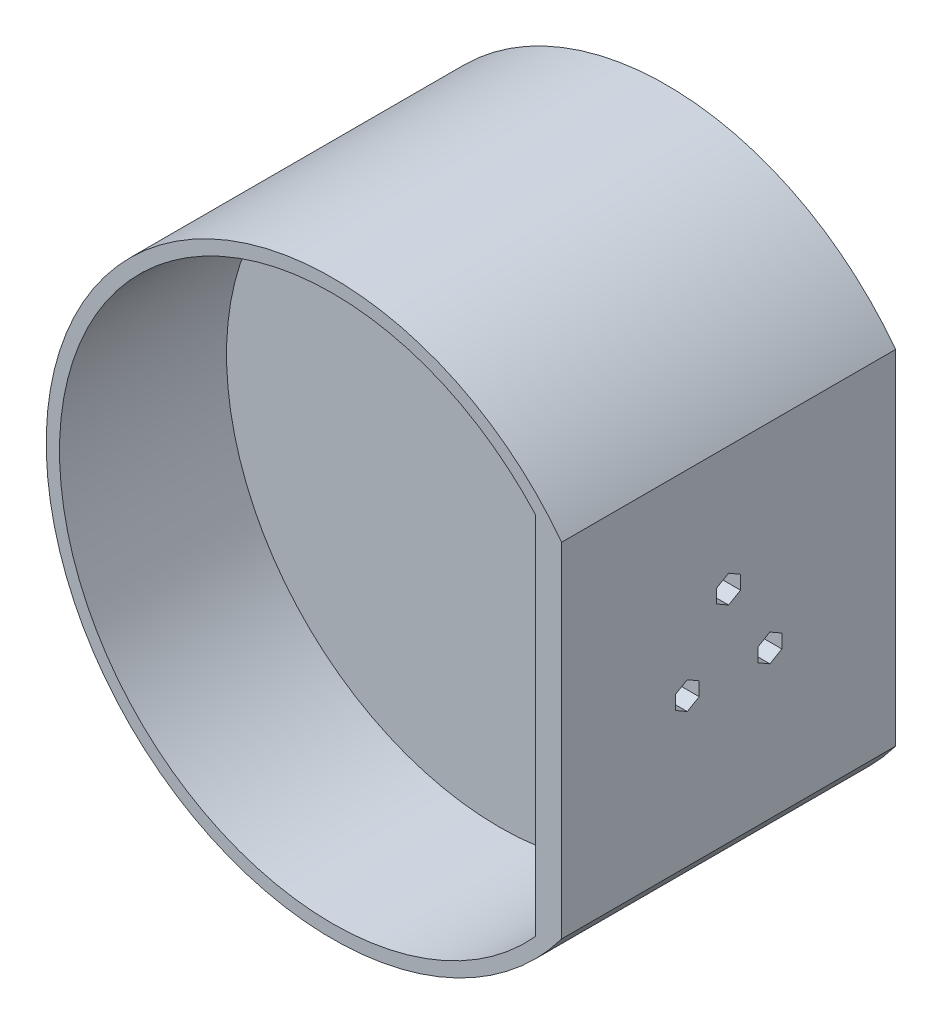
from build123d import *

# Parameters (mm, degrees)
EXTRUDE_3_DEPTH     = 70
CUT_EXTRUDE_2_DEPTH = 5
CUT_EXTRUDE_4_DEPTH = 35


with BuildPart() as part:
    # 草图1 → 凸台-拉伸3 (new body)
    with BuildSketch(Plane.XY):
        with BuildLine():
            Line((48, 36), (48, -36))
            ThreePointArc((48, -36), (-60, 0), (48, 36))
        make_face()
    extrude(amount=EXTRUDE_3_DEPTH)

    # 草图4 → 切除-拉伸2 (cut)
    with BuildSketch(Plane(origin=(48, 0, 0), x_dir=(0, 0, -1), z_dir=(1, 0, 0))):
        Polygon((-28.839745962, -3.556624327), (-28.839745962, -6.443375673), (-26.339745962, -7.886751346), (-23.839745962, -6.443375673), (-23.839745962, -3.556624327), (-26.339745962, -2.113248654), align=None)
        Polygon((-35, 7.113248654), (-32.5, 8.556624327), (-32.5, 11.443375673), (-35, 12.886751346), (-37.5, 11.443375673), (-37.5, 8.556624327), align=None)
        Polygon((-41.160254038, -3.556624327), (-43.660254038, -2.113248654), (-46.160254038, -3.556624327), (-46.160254038, -6.443375673), (-43.660254038, -7.886751346), (-41.160254038, -6.443375673), align=None)
    extrude(amount=-CUT_EXTRUDE_2_DEPTH, mode=Mode.SUBTRACT)

    # 草图6 → 切除-拉伸4 (cut)
    with BuildSketch(Plane.XY.offset(70)):
        with BuildLine():
            Line((42.4984665, 38.306424351), (42.4984665, -38.306424351))
            ThreePointArc((42.4984665, -38.306424351), (-57.214524392, 0), (42.4984665, 38.306424351))
        make_face()
    extrude(amount=-CUT_EXTRUDE_4_DEPTH, mode=Mode.SUBTRACT)


solid = part.part
